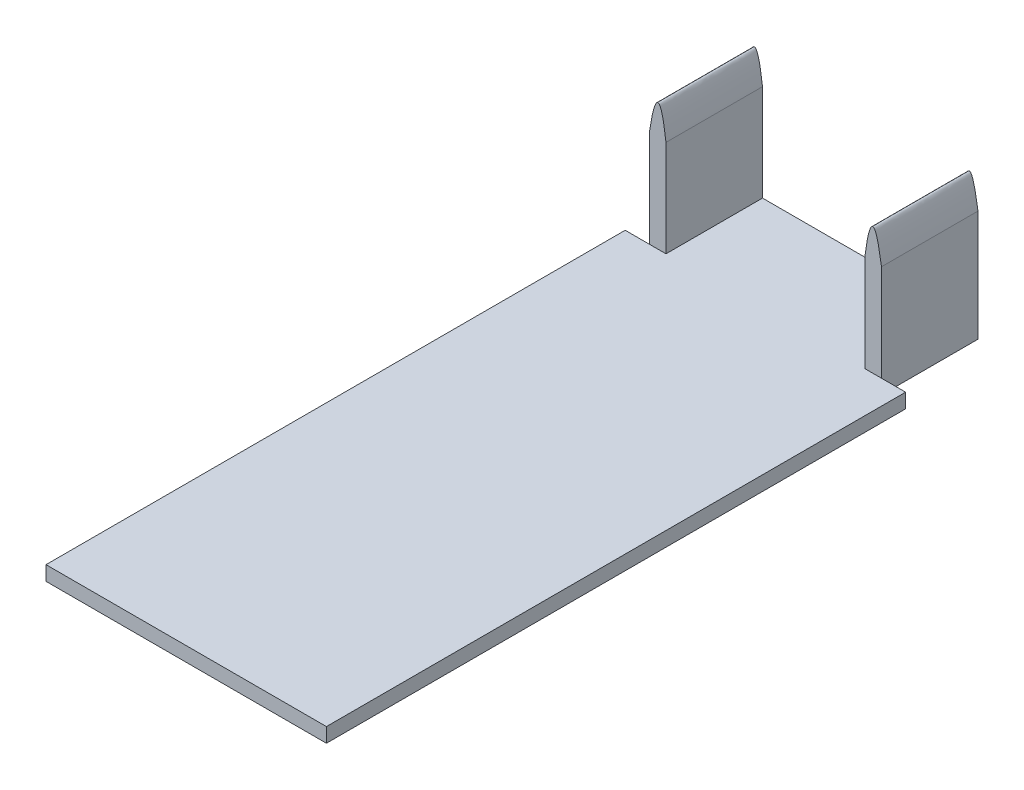
from build123d import *

# Parameters (mm, degrees)
BOSS_EXTRUDE1_DEPTH = 20
SKETCH2_W           = 5
SKETCH2_H           = 3
BOSS_EXTRUDE2_DEPTH = 120


with BuildPart() as part:
    # Sketch1 → Boss-Extrude1 (new body)
    with BuildSketch(Plane.XY):
        with BuildLine():
            Line((-24.05, 64.8), (-24.05, 41.8))
            Line((-24.05, 41.8), (24.05, 41.8))
            Line((24.05, 41.8), (24.05, 64.8))
            add(Edge.make_bspline(
                [(24.05, 64.8), (22.187774265, 77.400108054), (20.594686421, 64.8)],
                knots=[0, 0, 0, 1, 1, 1], degree=2))
            Line((20.594686421, 64.8), (20.594686421, 44.8))
            Line((20.594686421, 44.8), (-20.594686421, 44.8))
            Line((-20.594686421, 44.8), (-20.594686421, 64.8))
            add(Edge.make_bspline(
                [(-24.05, 64.8), (-22.187774265, 77.400108054), (-20.594686421, 64.8)],
                knots=[0, 0, 0, 1, 1, 1], degree=2))
        make_face()
    extrude(amount=BOSS_EXTRUDE1_DEPTH)

    # Sketch2 → Boss-Extrude2 (add)
    with BuildSketch(Plane.XY.offset(20)):
        with Locations((-26.55, 43.3)):
            Rectangle(SKETCH2_W, SKETCH2_H)
        Polygon((-24.05, 44.8), (-24.05, 41.8), (24.05, 41.8), (24.05, 44.8), (20.594686421, 44.8), (-20.594686421, 44.8), align=None)
        with Locations((26.55, 43.3)):
            Rectangle(SKETCH2_W, SKETCH2_H)
    extrude(amount=BOSS_EXTRUDE2_DEPTH)


solid = part.part
